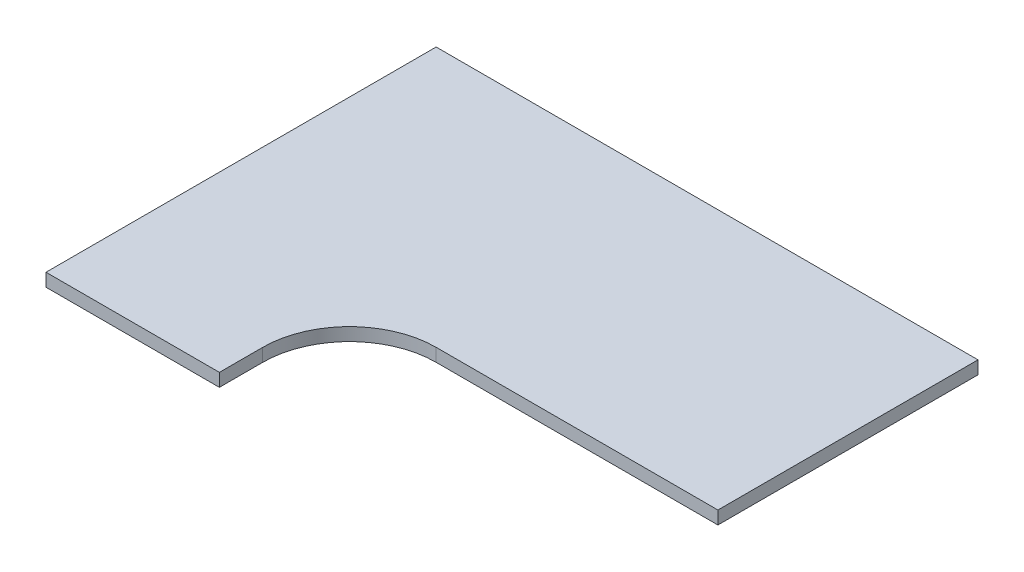
from build123d import *

# Parameters (mm, degrees)
BOSS_EXTRUDE1_DEPTH = 30


with BuildPart() as part:
    # Sketch1 → Boss-Extrude1 (new body)
    with BuildSketch(Plane(origin=(0, 0, 0), x_dir=(1, 0, 0), z_dir=(0, 1, 0))):
        with BuildLine():
            Line((0, 0), (0, -900))
            Line((0, -900), (400, -900))
            Line((400, -900), (400, -800))
            ThreePointArc((400, -800), (458.578643763, -658.578643763), (600, -600))
            Line((600, -600), (1250, -600))
            Line((1250, -600), (1250, 0))
            Line((1250, 0), (0, 0))
        make_face()
    extrude(amount=BOSS_EXTRUDE1_DEPTH)


solid = part.part
